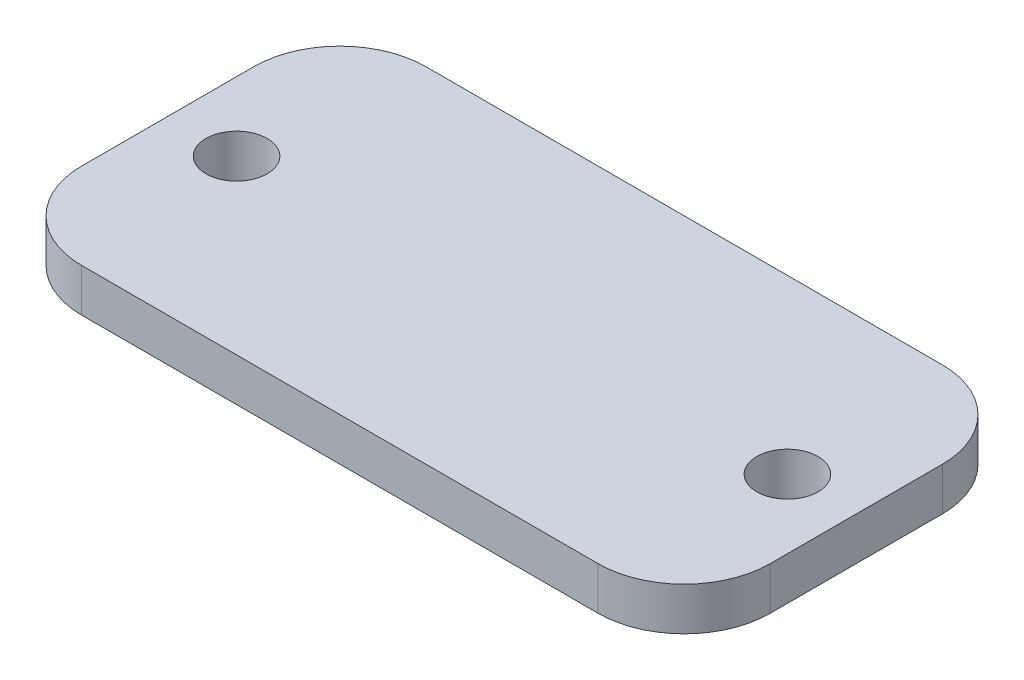
from build123d import *

# Parameters (mm, degrees)
SKETCH1_W           = 25.4
SKETCH1_H           = 12.7
BOSS_EXTRUDE1_DEPTH = 1.5875
FILLET1_R           = 3.175
SKETCH2_R           = 1.1303
CUT_EXTRUDE1_DEPTH  = 29.442400677


with BuildPart() as part:
    # Sketch1 → Boss-Extrude1 (new body)
    with BuildSketch(Plane(origin=(0, 0, 0), x_dir=(1, 0, 0), z_dir=(0, 1, 0))):
        with Locations((12.7, 6.35)):
            Rectangle(SKETCH1_W, SKETCH1_H)
    extrude(amount=BOSS_EXTRUDE1_DEPTH)

    # Fillet1
    fillet1_edges = [part.edges().sort_by_distance(p)[0] for p in [
        (0, 0.79375, -12.7),
        (25.4, 0.79375, -12.7),
        (25.4, 0.79375, 0),
        (0, 0.79375, 0),
    ]]
    fillet(fillet1_edges, radius=FILLET1_R)

    # Sketch2 → Cut-Extrude1 (cut, through all)
    with BuildSketch(Plane(origin=(0, 1.5875, 0), x_dir=(1, 0, 0), z_dir=(0, 1, 0))):
        with Locations(Location((2.54, 6.35, 0), (0, 0, 270))):
            Circle(SKETCH2_R)
        with Locations(Location((22.86, 6.35, 0), (0, 0, 90))):
            Circle(SKETCH2_R)
    extrude(amount=-CUT_EXTRUDE1_DEPTH, mode=Mode.SUBTRACT)


solid = part.part
